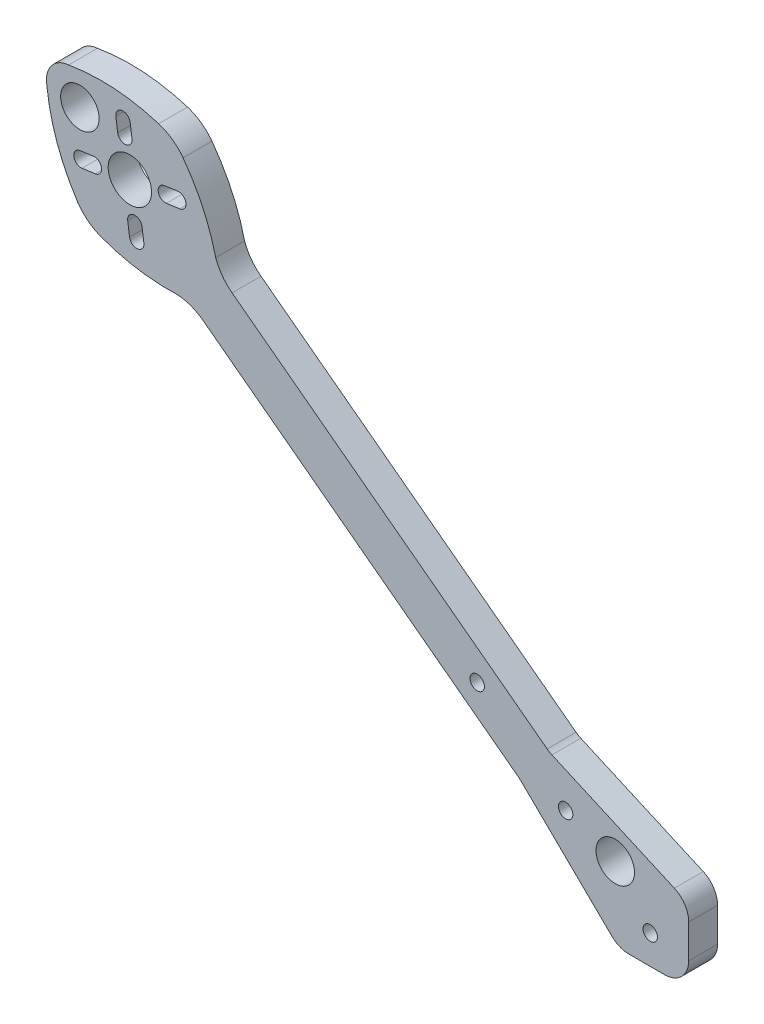
from build123d import *

# Parameters (mm, degrees)
CROQUIS1_R              = 1.5
CROQUIS1_R_2            = 4
CROQUIS1_R_3            = 4.5
SALIENTE_EXTRUIR1_DEPTH = 6


with BuildPart() as part:
    # Croquis1 → Saliente-Extruir1 (new body)
    with BuildSketch(Plane.XY):
        with BuildLine():
            ThreePointArc((-153.452479084, 65.245629882), (-149.916945178, 66.710095976), (-148.452479084, 70.245629882))
            Line((-148.452479084, 70.245629882), (-148.452479084, 77.241660705))
            ThreePointArc((-148.452479084, 77.241660705), (-149.261781775, 79.96894068), (-151.427701509, 81.813342646))
            Line((-151.427701509, 81.813342646), (-176.86343393, 93.078715272))
            ThreePointArc((-176.86343393, 93.078715272), (-177.372149016, 93.339780675), (-177.847731471, 93.657219664))
            Line((-177.847731471, 93.657219663), (-243.282498112, 142.965853083))
            ThreePointArc((-243.282498112, 142.965853083), (-245.323514753, 145.031918552), (-246.684791002, 147.597323475))
            ThreePointArc((-246.684791002, 147.597323475), (-249.33333249, 155.226277836), (-253.46024382, 162.167770437))
            ThreePointArc((-253.46024382, 162.167770437), (-255.706791789, 164.36963499), (-258.526200935, 165.764668091))
            ThreePointArc((-258.526200935, 165.764668091), (-267.807267276, 167.484933762), (-277.233031605, 166.98246665))
            ThreePointArc((-277.233031605, 166.98246665), (-280.839635864, 165.006508056), (-281.744934312, 160.994969527))
            ThreePointArc((-281.744934312, 160.994969527), (-279.629843944, 151.795844616), (-275.418009863, 143.348480526))
            ThreePointArc((-275.418009863, 143.348480526), (-273.299883496, 141.022813744), (-270.564082899, 139.470209357))
            ThreePointArc((-270.564082899, 139.470209357), (-262.753961023, 137.416502238), (-254.690502443, 136.973385563))
            ThreePointArc((-254.690502443, 136.973385563), (-251.84925837, 136.371964278), (-249.300648344, 134.979497983))
            Line((-249.300648344, 134.979497983), (-183.81253652, 85.630666085))
            ThreePointArc((-183.81253652, 85.630666085), (-183.561856018, 85.428793496), (-183.324683063, 85.211210762))
            Line((-183.324683063, 85.211210762), (-164.378251009, 66.671907655))
            ThreePointArc((-164.378251009, 66.671907655), (-162.769627082, 65.615910067), (-160.881322437, 65.245629882))
            Line((-160.881322437, 65.245629882), (-153.452479084, 65.245629882))
        make_face()
        with Locations((-156.438834184, 71.263780114)):
            Circle(CROQUIS1_R, mode=Mode.SUBTRACT)
        with Locations((-174.012762489, 84.506684964)):
            Circle(CROQUIS1_R, mode=Mode.SUBTRACT)
        with Locations((-163.702479084, 80.495629882)):
            Circle(CROQUIS1_R_2, mode=Mode.SUBTRACT)
        with Locations((-192.377432136, 98.345456156)):
            Circle(CROQUIS1_R, mode=Mode.SUBTRACT)
        with BuildLine():
            Line((-271.680758131, 150.180525793), (-274.453508724, 149.79084111))
            ThreePointArc((-274.453508724, 149.79084111), (-276.147670478, 151.067483562), (-274.871028026, 152.761645316))
            Line((-274.871028026, 152.761645316), (-272.098277434, 153.151329999))
            ThreePointArc((-272.098277434, 153.151329999), (-270.404115679, 151.874687547), (-271.680758131, 150.180525793))
        make_face(mode=Mode.SUBTRACT)
        with BuildLine():
            Line((-261.989778965, 145.534030037), (-261.600094282, 142.761279445))
            ThreePointArc((-261.600094282, 142.761279445), (-262.876736734, 141.06711769), (-264.570898489, 142.343760142))
            Line((-264.570898489, 142.343760142), (-264.960583171, 145.116510734))
            ThreePointArc((-264.960583171, 145.116510734), (-263.68394072, 146.810672489), (-261.989778965, 145.534030037))
        make_face(mode=Mode.SUBTRACT)
        with Locations((-264.51202067, 152.702767498)):
            Circle(CROQUIS1_R_3, mode=Mode.SUBTRACT)
        with BuildLine():
            Line((-257.34328321, 155.225009203), (-254.570532617, 155.614693886))
            ThreePointArc((-254.570532617, 155.614693886), (-252.876370863, 154.338051434), (-254.153013314, 152.64388968))
            Line((-254.153013314, 152.64388968), (-256.925763907, 152.254204997))
            ThreePointArc((-256.925763907, 152.254204997), (-258.619925661, 153.530847449), (-257.34328321, 155.225009203))
        make_face(mode=Mode.SUBTRACT)
        with Locations((-274.894282301, 160.526362799)):
            Circle(CROQUIS1_R_2, mode=Mode.SUBTRACT)
        with BuildLine():
            Line((-267.034262376, 159.871504959), (-267.423947058, 162.644255551))
            ThreePointArc((-267.423947058, 162.644255551), (-266.147304607, 164.338417306), (-264.453142852, 163.061774854))
            Line((-264.453142852, 163.061774854), (-264.063458169, 160.289024262))
            ThreePointArc((-264.063458169, 160.289024262), (-265.340100621, 158.594862507), (-267.034262376, 159.871504959))
        make_face(mode=Mode.SUBTRACT)
    extrude(amount=SALIENTE_EXTRUIR1_DEPTH)


solid = part.part
